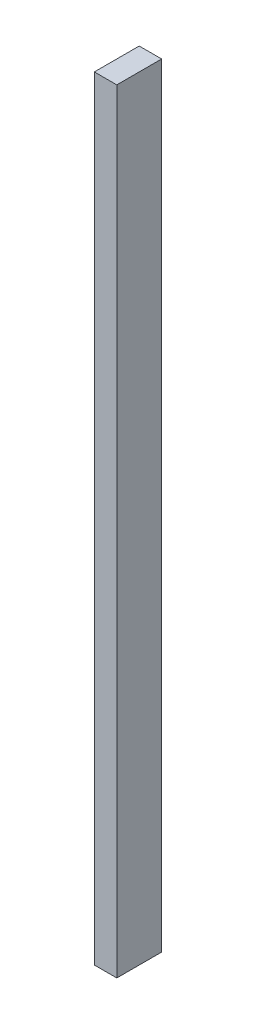
from build123d import *

# Parameters (mm, degrees)
SKETCH1_W           = 25.4
SKETCH1_H           = 50.8
BOSS_EXTRUDE1_DEPTH = 875.792


with BuildPart() as part:
    # Sketch1 → Boss-Extrude1 (new body)
    with BuildSketch(Plane(origin=(0, 0, 0), x_dir=(1, 0, 0), z_dir=(0, 1, 0))):
        Rectangle(SKETCH1_W, SKETCH1_H)
    extrude(amount=BOSS_EXTRUDE1_DEPTH)


solid = part.part
